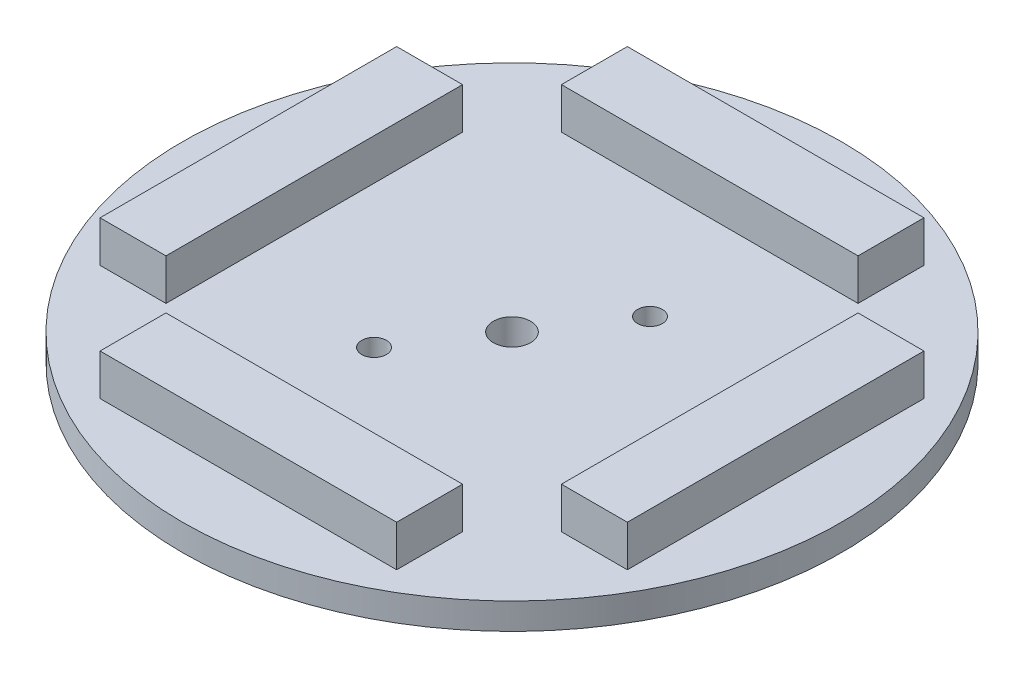
from build123d import *

# Parameters (mm, degrees)
SKETCH1_R                    = 20
SKETCH1_R_2                  = 1.1303
SKETCH1_R_3                  = 0.75
PCB_DEPTH                    = 1.6
SKETCH2_W                    = 18
SKETCH2_H                    = 4
HIROSE_CONNECTOR_STACK_DEPTH = 2.5
CIRPATTERN1_COUNT            = 4


with BuildPart() as part:
    # Sketch1 → PCB (new body)
    with BuildSketch(Plane(origin=(0, 0, 0), x_dir=(1, 0, 0), z_dir=(0, 1, 0))):
        with Locations(Location((0, 0, 0), (0, 0, 270))):
            Circle(SKETCH1_R)
        with Locations(Location((0, 0, 0), (0, 0, 270))):
            Circle(SKETCH1_R_2, mode=Mode.SUBTRACT)
        with Locations(Location((3.372542584, 5, 0), (0, 0, 270))):
            Circle(SKETCH1_R_3, mode=Mode.SUBTRACT)
        with Locations(Location((-3.372542584, -5, 0), (0, 0, 270))):
            Circle(SKETCH1_R_3, mode=Mode.SUBTRACT)
    extrude(amount=PCB_DEPTH)

    # Sketch2 → Hirose Connector Stack (add)
    with BuildSketch(Plane(origin=(0, 1.6, 0), x_dir=(1, 0, 0), z_dir=(0, 1, 0))):
        with Locations((0, 14)):
            Rectangle(SKETCH2_W, SKETCH2_H)
    hirose_connector_stack = extrude(amount=HIROSE_CONNECTOR_STACK_DEPTH)

    # CirPattern1: Hirose Connector Stack ×4 about axis
    cirpattern1_axis = Axis((0, 0, 0), (0, 1, 0))
    for i in range(1, CIRPATTERN1_COUNT):
        add(hirose_connector_stack.rotate(cirpattern1_axis, i * 360 / CIRPATTERN1_COUNT))


solid = part.part
